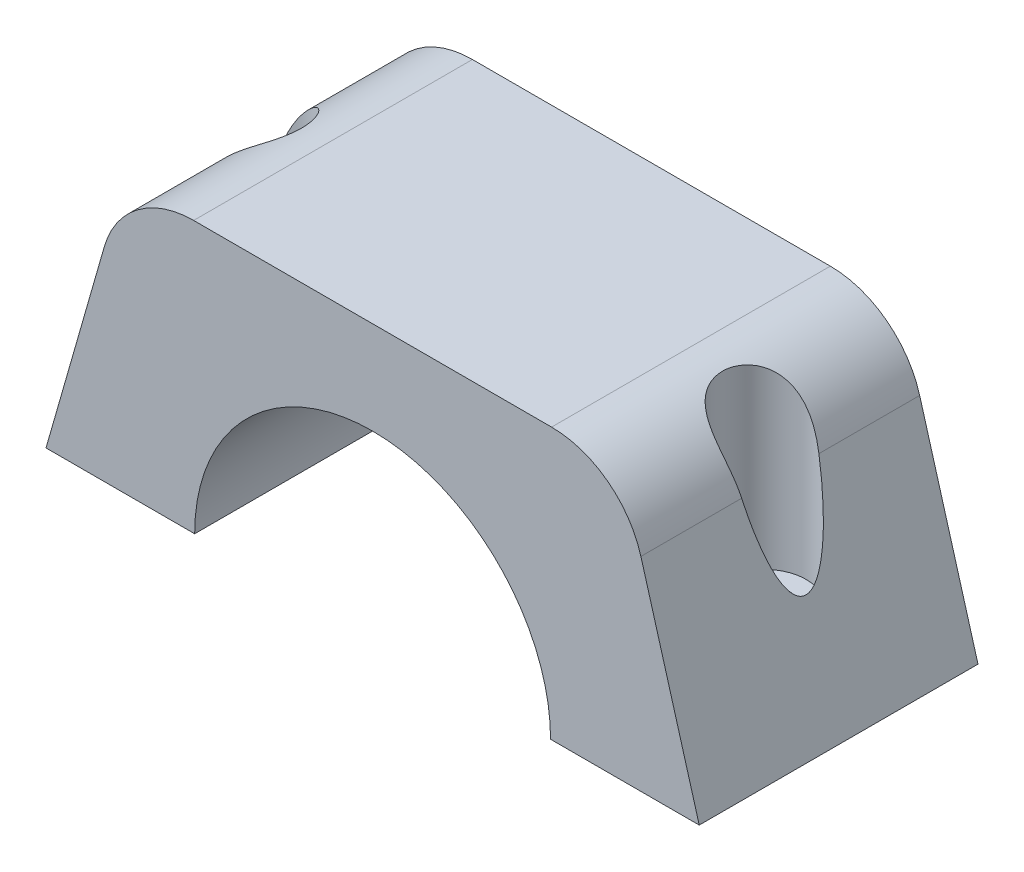
from build123d import *

# Parameters (mm, degrees)
BOSS_EXTRUDE1_DEPTH = 30
FILLET1_R           = 10
SKETCH2_R           = 2.5
CUT_EXTRUDE1_DEPTH  = 55.637395619
SKETCH3_R           = 4.5
CUT_EXTRUDE2_DEPTH  = 20


with BuildPart() as part:
    # Sketch1 → Boss-Extrude1 (new body)
    with BuildSketch(Plane.XY):
        with BuildLine():
            Line((-26.797076023, 29.15), (-35.15, 0))
            Line((-35.15, 0), (-19.15, 0))
            ThreePointArc((-19.15, 0), (0, 19.15), (19.15, 0))
            Line((19.15, 0), (35.15, 0))
            Line((35.15, 0), (26.797076023, 29.15))
            Line((26.797076023, 29.15), (-26.797076023, 29.15))
        make_face()
    extrude(amount=BOSS_EXTRUDE1_DEPTH)

    # Fillet1
    fillet1_edges = [part.edges().sort_by_distance(p)[0] for p in [
        (-26.797076023, 29.15, 15),
        (26.797076023, 29.15, 15),
    ]]
    fillet(fillet1_edges, radius=FILLET1_R)

    # Sketch2 → Cut-Extrude1 (cut, through all)
    with BuildSketch(Plane.XZ):
        with Locations((-27.15, 15)):
            Circle(SKETCH2_R)
        with Locations(Location((27.15, 15, 0), (0, 0, 180))):
            Circle(SKETCH2_R)
    extrude(amount=-CUT_EXTRUDE1_DEPTH, mode=Mode.SUBTRACT)

    # Sketch3 → Cut-Extrude2 (cut)
    with BuildSketch(Plane(origin=(0, 29.15, 0), x_dir=(1, 0, 0), z_dir=(0, 1, 0))):
        with Locations(Location((27.15, -15, 0), (0, 0, 180))):
            Circle(SKETCH3_R)
        with Locations(Location((-27.15, -15, 0), (0, 0, 180))):
            Circle(SKETCH3_R)
    extrude(amount=-CUT_EXTRUDE2_DEPTH, mode=Mode.SUBTRACT)


solid = part.part
